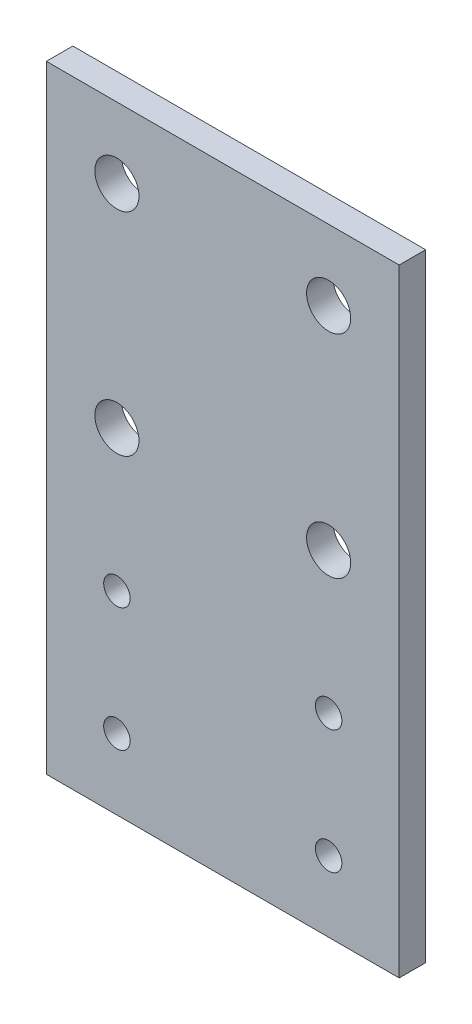
from build123d import *

# Parameters (mm, degrees)
EXTRUDE_1_DEPTH     = 3
SKETCH_2_R          = 1.55
CUT_EXTRUDE_1_DEPTH = 73.862884928
SKETCH_3_R          = 1.5
SKETCH_3_R_2        = 2.5
CUT_EXTRUDE_2_DEPTH = 73.862884928
SKETCH_4_W          = 40
SKETCH_4_H          = 35
CUT_EXTRUDE_3_DEPTH = 73.862884928


with BuildPart() as part:
    # 草图1 → 凸台-拉伸1 (new body)
    with BuildSketch(Plane.XY):
        Polygon((-20, 35), (0, 70), (20, 70), (20, 35), (20, -35), (-20, -35), align=None)
    extrude(amount=EXTRUDE_1_DEPTH)

    # 草图2 → 切除-拉伸1 (cut, through all)
    with BuildSketch(Plane.XY.offset(3)):
        with Locations((17, 61)):
            Circle(SKETCH_2_R)
        with Locations((6, 61)):
            Circle(SKETCH_2_R)
        with Locations((17, 41)):
            Circle(SKETCH_2_R)
        with Locations((4.851224059, 41)):
            Circle(SKETCH_2_R)
    extrude(amount=-CUT_EXTRUDE_1_DEPTH, mode=Mode.SUBTRACT)

    # 草图3 → 切除-拉伸2 (cut, through all)
    with BuildSketch(Plane.XY.offset(3)):
        with Locations((12, -27)):
            Circle(SKETCH_3_R)
        with Locations((-12, -27)):
            Circle(SKETCH_3_R)
        with Locations((12, -13)):
            Circle(SKETCH_3_R)
        with Locations((-12, -13)):
            Circle(SKETCH_3_R)
        with Locations((12, 3)):
            Circle(SKETCH_3_R_2)
        with Locations((-12, 3)):
            Circle(SKETCH_3_R_2)
        with Locations((12, 27)):
            Circle(SKETCH_3_R_2)
        with Locations((-12, 27)):
            Circle(SKETCH_3_R_2)
    extrude(amount=-CUT_EXTRUDE_2_DEPTH, mode=Mode.SUBTRACT)

    # 草图4 → 切除-拉伸3 (cut, through all)
    with BuildSketch(Plane(origin=(0, 0, 0), x_dir=(-1, 0, 0), z_dir=(0, 0, -1))):
        with Locations((0, 52.5)):
            Rectangle(SKETCH_4_W, SKETCH_4_H)
    extrude(amount=-CUT_EXTRUDE_3_DEPTH, mode=Mode.SUBTRACT)


solid = part.part
